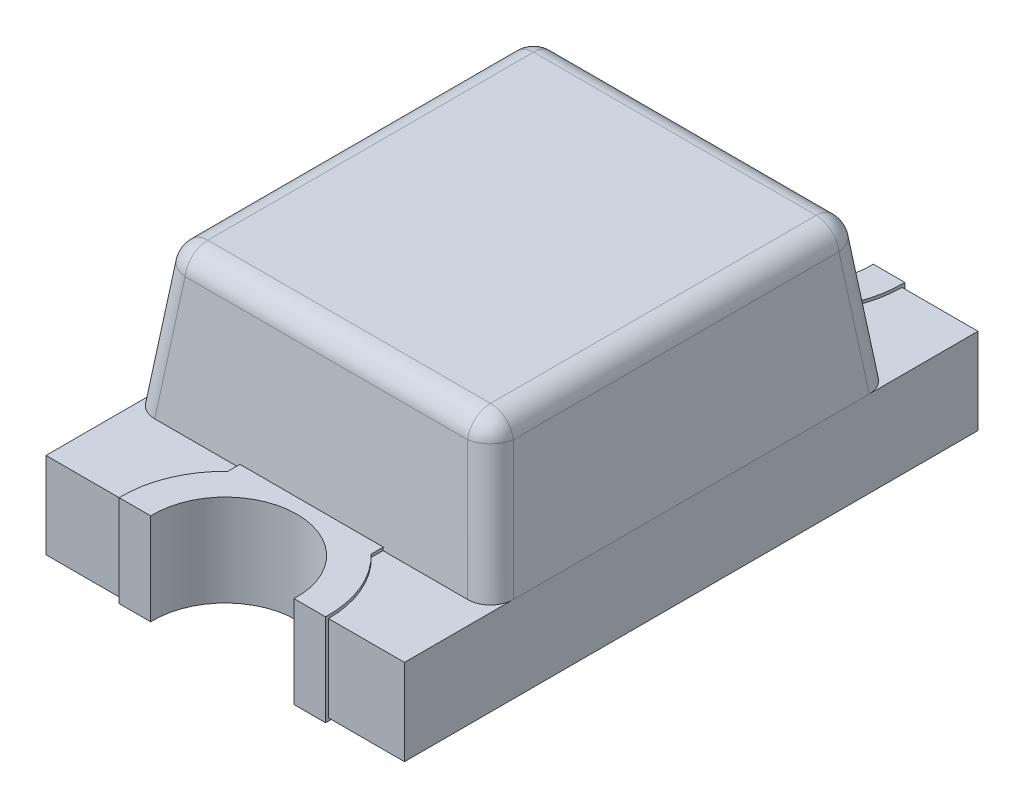
from build123d import *

# Parameters (mm, degrees)
BASE_DEPTH        = 0.15
LEAD_TOP_DEPTH    = 0.16
LEAD_START        = -0.01
LEAD_BOTTOM_DEPTH = 0.01
SKETCH7_W         = 1.25
SKETCH7_H         = 1.4
LENS_DEPTH        = 0.5
LENS_TAPER        = 7
FILLET_2_R        = 0.08


with BuildPart() as part:
    # Sketch1 → Base (new, symmetric)
    with BuildSketch(Plane(origin=(0, 0, 0), x_dir=(1, 0, 0), z_dir=(0, 1, 0))):
        with BuildLine():
            Line((-0.625, -1), (-0.25, -1))
            ThreePointArc((-0.25, -1), (0, -0.75), (0.25, -1))
            Line((0.25, -1), (0.625, -1))
            Line((0.625, -1), (0.625, 1))
            Line((0.625, 1), (0.25, 1))
            ThreePointArc((0.25, 1), (0, 0.75), (-0.25, 1))
            Line((-0.25, 1), (-0.625, 1))
            Line((-0.625, 1), (-0.625, -1))
        make_face()
    extrude(amount=BASE_DEPTH, both=True)

    # Sketch8 → Lead top (add, symmetric)
    with BuildSketch(Plane(origin=(0, 0, 0), x_dir=(1, 0, 0), z_dir=(0, 1, 0))):
        with BuildLine():
            Line((-0.25, -0.740963323), (-0.25, -0.6))
            Line((-0.25, -0.6), (0.25, -0.6))
            Line((0.25, -0.6), (0.25, -0.740963323))
            ThreePointArc((0.25, -0.740963323), (0.333283391, -0.86390378), (0.359861084, -1.01))
            Line((0.359861084, -1.01), (0.24979992, -1.01))
            ThreePointArc((0.24979992, -1.01), (0, -0.75), (-0.24979992, -1.01))
            Line((-0.24979992, -1.01), (-0.359861084, -1.01))
            ThreePointArc((-0.359861084, -1.01), (-0.333283391, -0.86390378), (-0.25, -0.740963323))
        make_face()
        with BuildLine():
            Line((-0.359861084, 1.01), (-0.24979992, 1.01))
            ThreePointArc((-0.24979992, 1.01), (0, 0.75), (0.24979992, 1.01))
            Line((0.24979992, 1.01), (0.359861084, 1.01))
            ThreePointArc((0.359861084, 1.01), (0, 0.64), (-0.359861084, 1.01))
        make_face()
    extrude(amount=LEAD_TOP_DEPTH, both=True)

    # Sketch10 → Lead bottom (add)
    with BuildSketch(Plane.XZ.offset(0.16).offset(LEAD_START)):
        with BuildLine():
            Line((-0.359861084, 1.01), (-0.359861084, 0.6))
            Line((-0.359861084, 0.6), (0.359861084, 0.6))
            Line((0.359861084, 0.6), (0.359861084, 1.01))
            Line((0.359861084, 1.01), (0.24979992, 1.01))
            ThreePointArc((0.24979992, 1.01), (0, 0.75), (-0.24979992, 1.01))
            Line((-0.24979992, 1.01), (-0.359861084, 1.01))
        make_face()
        with BuildLine():
            Line((-0.359861084, -0.6), (0.359861084, -0.6))
            Line((0.359861084, -0.6), (0.359861084, -1.01))
            Line((0.359861084, -1.01), (0.24979992, -1.01))
            ThreePointArc((0.24979992, -1.01), (0, -0.75), (-0.24979992, -1.01))
            Line((-0.24979992, -1.01), (-0.359861084, -1.01))
            Line((-0.359861084, -1.01), (-0.359861084, -0.6))
        make_face()
    extrude(amount=LEAD_BOTTOM_DEPTH)

    # Sketch7 → Lens (add)
    with BuildSketch(Plane(origin=(0, 0.15, 0), x_dir=(1, 0, 0), z_dir=(0, 1, 0))):
        Rectangle(SKETCH7_W, SKETCH7_H)
    extrude(amount=LENS_DEPTH, taper=LENS_TAPER)

    # Fillet 2
    fillet_2_edges = [part.edges().sort_by_distance(p)[0] for p in [
        (-0.59430386, 0.4, 0.66930386),
        (0.59430386, 0.4, -0.66930386),
        (0.59430386, 0.4, 0.66930386),
        (-0.59430386, 0.4, -0.66930386),
        (0.56360772, 0.65, 0),
        (0, 0.65, -0.63860772),
        (-0.56360772, 0.65, 0),
        (0, 0.65, 0.63860772),
    ]]
    fillet(fillet_2_edges, radius=FILLET_2_R)


solid = part.part
